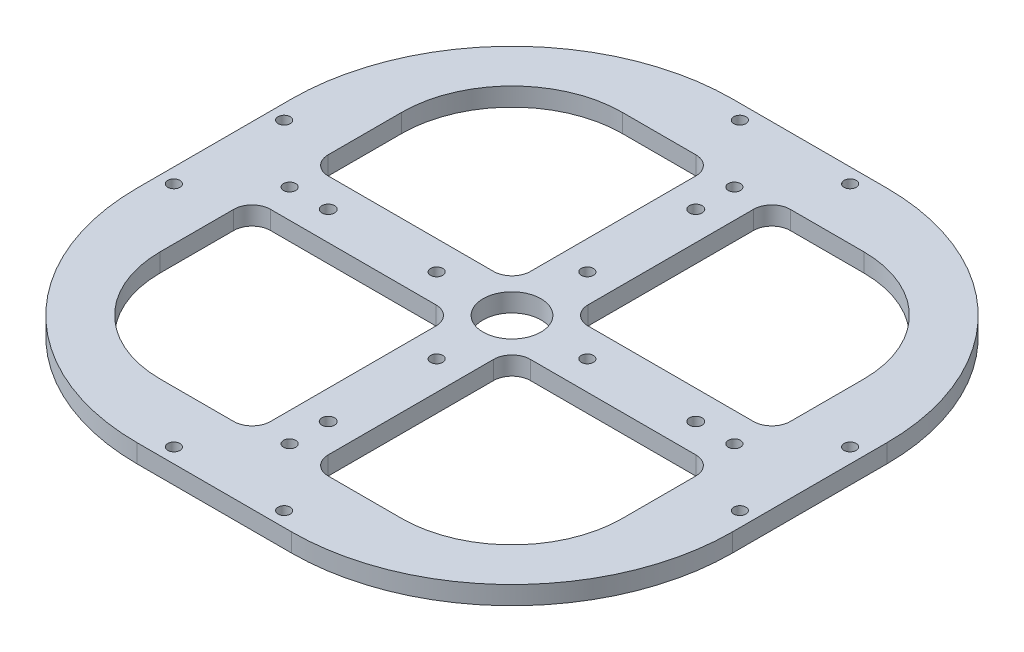
from build123d import *

# Parameters (mm, degrees)
SKETCH1_W                = 205.74
SKETCH1_H                = 205.74
SKETCH1_R                = 2.200000045
BOSS_EXTRUDE1_DEPTH      = 6.35
SKETCH3_R                = 9.999999939
CUT_EXTRUDE2_DEPTH       = 146.618667416
SKETCH4_W                = 69.85
SKETCH4_H                = 69.85
CUT_EXTRUDE3_DEPTH       = 146.618667416
FILLET4_R                = 6.35
CIRPATTERN6_COUNT        = 4
FILLET4_OF_CIRPATTERN6_R = 6.35
FILLET8_R                = 38.1
FILLET9_R                = 76.2
SKETCH10_R               = 2.099999991
CUT_EXTRUDE6_DEPTH       = 146.618667416
SKETCH11_R               = 4.000000001
CUT_EXTRUDE7_DEPTH       = 3.000000096
CIRPATTERN4_COUNT        = 4


with BuildPart() as part:
    # Sketch1 → Boss-Extrude1 (new body)
    with BuildSketch(Plane(origin=(0, 0, 0), x_dir=(1, 0, 0), z_dir=(0, 1, 0))):
        Rectangle(SKETCH1_W, SKETCH1_H)
        with Locations(Location((63.5, 0, 0), (0, 0, 270))):
            Circle(SKETCH1_R, mode=Mode.SUBTRACT)
        with Locations(Location((0, -63.5, 0), (0, 0, 270))):
            Circle(SKETCH1_R, mode=Mode.SUBTRACT)
        with Locations(Location((-63.5, 0, 0), (0, 0, 270))):
            Circle(SKETCH1_R, mode=Mode.SUBTRACT)
        with Locations(Location((0, 63.5, 0), (0, 0, 270))):
            Circle(SKETCH1_R, mode=Mode.SUBTRACT)
    extrude(amount=BOSS_EXTRUDE1_DEPTH)

    # Sketch3 → Cut-Extrude2 (cut, through all)
    with BuildSketch(Plane(origin=(0, 6.35, 0), x_dir=(1, 0, 0), z_dir=(0, 1, 0))):
        with Locations(Location((0, 0, 0), (0, 0, 270))):
            Circle(SKETCH3_R)
    extrude(amount=-CUT_EXTRUDE2_DEPTH, mode=Mode.SUBTRACT)

    # Sketch4 → Cut-Extrude3 (cut, through all)
    with BuildSketch(Plane(origin=(0, 6.35, 0), x_dir=(1, 0, 0), z_dir=(0, 1, 0))):
        with Locations((-44.901280605, 44.901280605)):
            Rectangle(SKETCH4_W, SKETCH4_H)
    cut_extrude3 = extrude(amount=-CUT_EXTRUDE3_DEPTH, mode=Mode.SUBTRACT)

    # Fillet4
    fillet4_edges = [part.edges().sort_by_distance(p)[0] for p in [
        (-9.976280605, 3.175, -79.826280605),
        (-9.976280605, 3.175, -9.976280605),
        (-79.826280605, 3.175, -9.976280605),
    ]]
    fillet(fillet4_edges, radius=FILLET4_R)

    # CirPattern6: Cut-Extrude3 ×4 about axis
    cirpattern6_axis = Axis((0, 0, 0), (0, 1, 0))
    for i in range(1, CIRPATTERN6_COUNT):
        add(cut_extrude3.rotate(cirpattern6_axis, i * 360 / CIRPATTERN6_COUNT), mode=Mode.SUBTRACT)

    # Fillet4 of CirPattern6
    fillet4_of_cirpattern6_edges = [part.edges().sort_by_distance(p)[0] for p in [
        (-79.826280605, 3.175, 9.976280605),
        (-9.976280605, 3.175, 9.976280605),
        (-9.976280605, 3.175, 79.826280605),
        (9.976280605, 3.175, 79.826280605),
        (9.976280605, 3.175, 9.976280605),
        (79.826280605, 3.175, 9.976280605),
        (79.826280605, 3.175, -9.976280605),
        (9.976280605, 3.175, -9.976280605),
        (9.976280605, 3.175, -79.826280605),
    ]]
    fillet(fillet4_of_cirpattern6_edges, radius=FILLET4_OF_CIRPATTERN6_R)

    # Fillet8
    fillet8_edges = [part.edges().sort_by_distance(p)[0] for p in [
        (-79.826280605, 3.175, -79.826280605),
        (79.826280605, 3.175, -79.826280605),
        (79.826280605, 3.175, 79.826280605),
        (-79.826280605, 3.175, 79.826280605),
    ]]
    fillet(fillet8_edges, radius=FILLET8_R)

    # Fillet9
    fillet9_edges = [part.edges().sort_by_distance(p)[0] for p in [
        (102.87, 3.175, 102.87),
        (-102.87, 3.175, 102.87),
        (-102.87, 3.175, -102.87),
        (102.87, 3.175, -102.87),
    ]]
    fillet(fillet9_edges, radius=FILLET9_R)

    # Sketch10 → Cut-Extrude6 (cut, through all)
    with BuildSketch(Plane(origin=(0, 6.35, 0), x_dir=(1, 0, 0), z_dir=(0, 1, 0))):
        with Locations(Location((0, -26.035, 0), (0, 0, 270))):
            Circle(SKETCH10_R)
        with Locations(Location((0, -76.835, 0), (0, 0, 270))):
            Circle(SKETCH10_R)
        with Locations(Location((-19.05, -97.79, 0), (0, 0, 270))):
            Circle(SKETCH10_R)
        with Locations(Location((19.05, -97.79, 0), (0, 0, 270))):
            Circle(SKETCH10_R)
    cut_extrude6 = extrude(amount=-CUT_EXTRUDE6_DEPTH, mode=Mode.SUBTRACT)

    # Sketch11 → Cut-Extrude7 (cut)
    with BuildSketch(Plane.XZ):
        with Locations(Location((-19.05, 97.79, 0), (0, 0, 270))):
            Circle(SKETCH11_R)
        with Locations(Location((19.05, 97.79, 0), (0, 0, 270))):
            Circle(SKETCH11_R)
        with Locations(Location((0, 76.835, 0), (0, 0, 270))):
            Circle(SKETCH11_R)
        with Locations(Location((0, 26.035, 0), (0, 0, 270))):
            Circle(SKETCH11_R)
    cut_extrude7 = extrude(amount=-CUT_EXTRUDE7_DEPTH, mode=Mode.SUBTRACT)

    # CirPattern4: Cut-Extrude6, Cut-Extrude7 ×4 about axis
    cirpattern4_axis = Axis((0, 0, 0), (0, 1, 0))
    add([cut_extrude6.rotate(cirpattern4_axis, i * 360 / CIRPATTERN4_COUNT) for i in range(1, CIRPATTERN4_COUNT)], mode=Mode.SUBTRACT)
    add([cut_extrude7.rotate(cirpattern4_axis, i * 360 / CIRPATTERN4_COUNT) for i in range(1, CIRPATTERN4_COUNT)], mode=Mode.SUBTRACT)


solid = part.part
